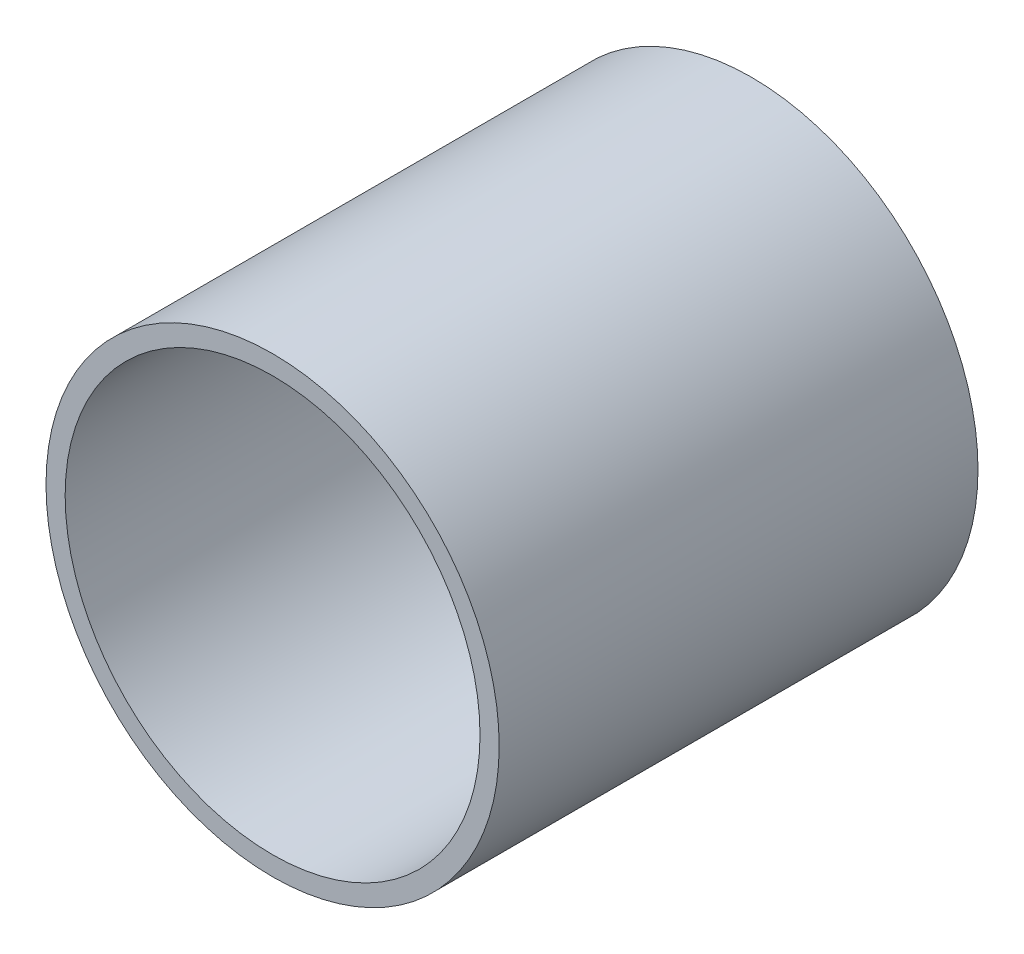
from build123d import *

# Parameters (mm, degrees)
SKETCH1_R      = 84.1375
SKETCH1_R_2    = 77.0255
BASEPIPE_DEPTH = 88.9


with BuildPart() as part:
    # Sketch1 → BasePipe (new, symmetric)
    with BuildSketch(Plane.XY):
        Circle(SKETCH1_R)
        Circle(SKETCH1_R_2, mode=Mode.SUBTRACT)
    extrude(amount=BASEPIPE_DEPTH, both=True)


solid = part.part
